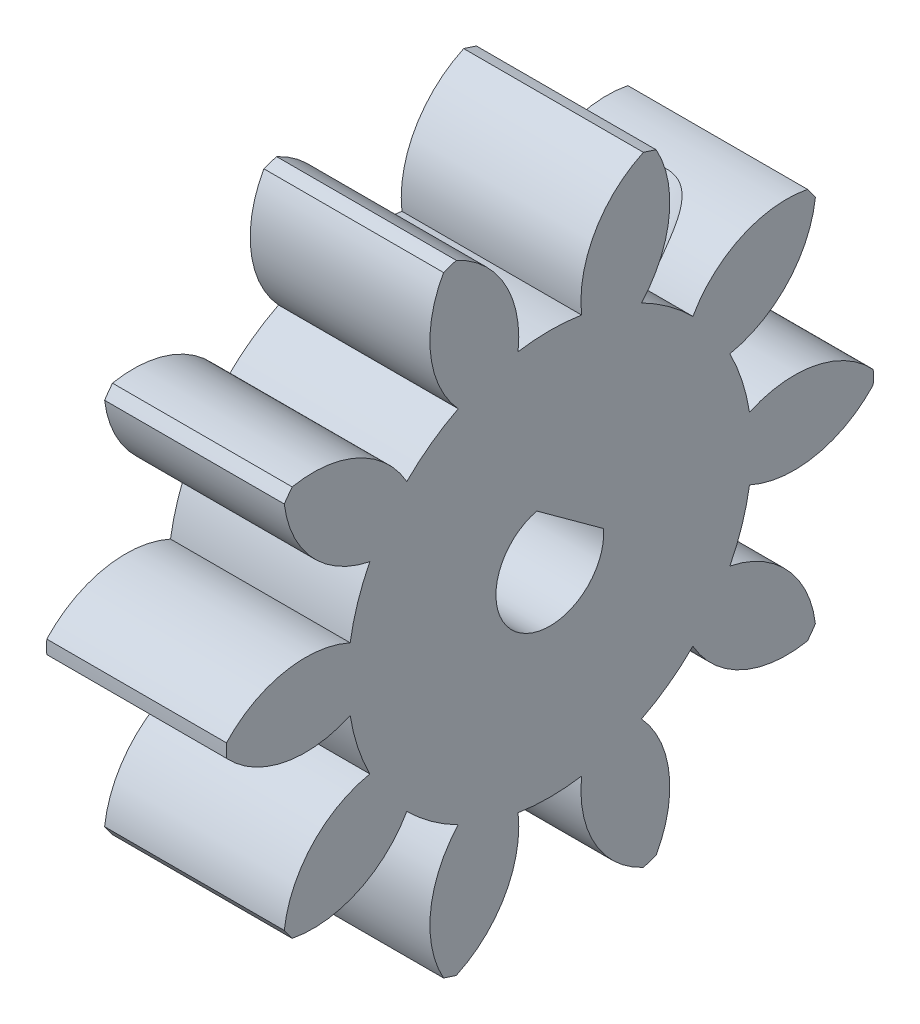
from build123d import *

# Parameters (mm, degrees)
BASPROSKE_W         = 5
BASPROSKE_H         = 9
TOOTHCUT_DEPTH      = 14.674794331
TEETHCUTS_COUNT     = 10
TEETHCUTS_ANGLE     = 324
BORSKE_R            = 1.5
BORE_DEPTH          = 50.0001524
EXTRUDE_1_DEPTH     = 5
SKETCH_3_R          = 1.5
CUT_EXTRUDE_1_DEPTH = 7


with BuildPart() as part:
    # BasProSke → Base-Revolve (revolve)
    with BuildSketch(Plane(origin=(0, 0, 0), x_dir=(1, 0, 0), z_dir=(0, 1, 0)), mode=Mode.PRIVATE) as base_revolve_sk:
        with Locations((2.5, 4.5)):
            Rectangle(BASPROSKE_W, BASPROSKE_H)
    revolve(base_revolve_sk.sketch.rotate(Axis((-10, 0, 0), (1, 0, 0)), 180), axis=Axis((-10, 0, 0), (1, 0, 0)))

    # TooCutSke → ToothCut (cut, through all)
    with BuildSketch(Plane(origin=(0, 0, 0), x_dir=(0, 0, -1), z_dir=(1, 0, 0))):
        with BuildLine():
            ThreePointArc((0.883878355, 5.554109745), (0, 5.624), (-0.883878355, 5.554109745))
            ThreePointArc((-0.883878355, 5.554109745), (-1.258245767, 7.379188248), (-2.637816971, 8.631324741))
            ThreePointArc((-2.637816971, 8.631324741), (0, 9.0254), (2.637816971, 8.631324741))
            ThreePointArc((2.637816971, 8.631324741), (1.258245767, 7.379188248), (0.883878355, 5.554109745))
        make_face()
    toothcut = extrude(amount=TOOTHCUT_DEPTH, mode=Mode.SUBTRACT)

    # TeethCuts: ToothCut ×10 about axis
    teethcuts_axis = Axis((-10, 0, 0), (1, 0, 0))
    for i in range(1, TEETHCUTS_COUNT):
        add(toothcut.rotate(teethcuts_axis, i * TEETHCUTS_ANGLE / (TEETHCUTS_COUNT - 1)), mode=Mode.SUBTRACT)

    # BorSke → Bore (cut, symmetric)
    with BuildSketch(Plane(origin=(0, 0, 0), x_dir=(0, 0, -1), z_dir=(1, 0, 0))):
        with Locations(Location((0, 0, 0), (0, 0, 180))):
            Circle(BORSKE_R)
    extrude(amount=BORE_DEPTH, both=True, mode=Mode.SUBTRACT)

    # 草圖2 → 填料-伸長1 (add, through all)
    with BuildSketch(Plane(origin=(0, 0, 0), x_dir=(0, 0, -1), z_dir=(1, 0, 0))):
        with BuildLine():
            ThreePointArc((-0.364292368, 1.45509143), (0.881677878, 1.213525492), (1.496446719, 0.10318535))
            Line((1.496446719, 0.10318535), (-0.364292368, 1.45509143))
        make_face()
    extrude(amount=EXTRUDE_1_DEPTH)

    # 草圖3 → 除料-伸長1 (cut)
    with BuildSketch(Plane(origin=(0, 0.77913839, -0.566077176), x_dir=(1, 0, 0), z_dir=(0, -0.8090169943749549, 0.5877852522924627))):
        with Locations(Location((2.5, 0, 0), (0, 0, 230.05549481))):
            Circle(SKETCH_3_R)
    extrude(amount=-CUT_EXTRUDE_1_DEPTH, mode=Mode.SUBTRACT)


solid = part.part
